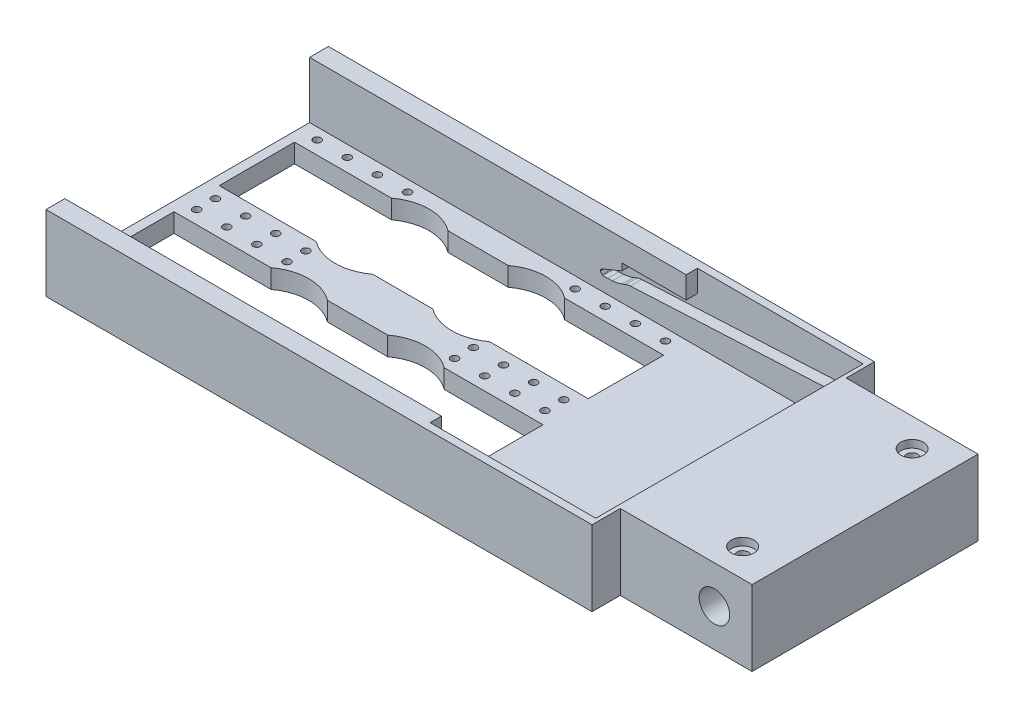
from build123d import *

# Parameters (mm, degrees)
SKETCH1_W           = 180
SKETCH1_H           = 75
SKETCH1_R           = 1.5
BOSS_EXTRUDE1_DEPTH = 20
SKETCH2_R           = 4.05
CUT_EXTRUDE1_DEPTH  = 119.84864324
SKETCH3_R           = 1
CUT_EXTRUDE2_DEPTH  = 100.530146245
SKETCH6_W           = 35
SKETCH6_H           = 7.5
CUT_EXTRUDE3_DEPTH  = 100.530146245
SKETCH7_W           = 140
SKETCH7_H           = 65
CUT_EXTRUDE4_DEPTH  = 15
SKETCH11_R          = 3
CUT_EXTRUDE7_DEPTH  = 2
CUT_EXTRUDE8_DEPTH  = 35.5


with BuildPart() as part:
    # Sketch1 → Boss-Extrude1 (new body)
    with BuildSketch(Plane(origin=(0, 0, 0), x_dir=(1, 0, 0), z_dir=(0, 1, 0))):
        Rectangle(SKETCH1_W, SKETCH1_H)
        with Locations(Location((80, 22.5, 0), (0, 0, 270))):
            Circle(SKETCH1_R, mode=Mode.SUBTRACT)
        with Locations(Location((80, -22.5, 0), (0, 0, 270))):
            Circle(SKETCH1_R, mode=Mode.SUBTRACT)
    extrude(amount=BOSS_EXTRUDE1_DEPTH)

    # Sketch2 → Cut-Extrude1 (cut, through all)
    with BuildSketch(Plane.XY.offset(37.5)):
        with Locations((80, 10)):
            Circle(SKETCH2_R)
    extrude(amount=-CUT_EXTRUDE1_DEPTH, mode=Mode.SUBTRACT)

    # Sketch3 → Cut-Extrude2 (cut, through all)
    with BuildSketch(Plane(origin=(0, 20, 0), x_dir=(1, 0, 0), z_dir=(0, 1, 0))):
        with Locations(Location((-85, 29.5, 0), (0, 0, 270))):
            Circle(SKETCH3_R)
        with Locations(Location((-85, 2.5, 0), (0, 0, 270))):
            Circle(SKETCH3_R)
        with Locations(Location((-77, 29.5, 0), (0, 0, 270))):
            Circle(SKETCH3_R)
        with Locations(Location((-69, 29.5, 0), (0, 0, 270))):
            Circle(SKETCH3_R)
        with Locations(Location((-61, 29.5, 0), (0, 0, 270))):
            Circle(SKETCH3_R)
        with Locations(Location((-77, 2.5, 0), (0, 0, 270))):
            Circle(SKETCH3_R)
        with Locations(Location((-69, 2.5, 0), (0, 0, 270))):
            Circle(SKETCH3_R)
        with Locations(Location((-61, 2.5, 0), (0, 0, 270))):
            Circle(SKETCH3_R)
        with Locations(Location((-16.5, 29.5, 0), (0, 0, 270))):
            Circle(SKETCH3_R)
        with Locations(Location((-16.5, 2.5, 0), (0, 0, 270))):
            Circle(SKETCH3_R)
        with Locations(Location((-8.5, 29.5, 0), (0, 0, 270))):
            Circle(SKETCH3_R)
        with Locations(Location((-0.5, 29.5, 0), (0, 0, 270))):
            Circle(SKETCH3_R)
        with Locations(Location((7.5, 29.5, 0), (0, 0, 270))):
            Circle(SKETCH3_R)
        with Locations(Location((-8.5, 2.5, 0), (0, 0, 270))):
            Circle(SKETCH3_R)
        with Locations(Location((-0.5, 2.5, 0), (0, 0, 270))):
            Circle(SKETCH3_R)
        with Locations(Location((7.5, 2.5, 0), (0, 0, 270))):
            Circle(SKETCH3_R)
        with Locations(Location((7.5, -2.5, 0), (0, 0, 90))):
            Circle(SKETCH3_R)
        with Locations(Location((-0.5, -2.5, 0), (0, 0, 90))):
            Circle(SKETCH3_R)
        with Locations(Location((-8.5, -2.5, 0), (0, 0, 90))):
            Circle(SKETCH3_R)
        with Locations(Location((7.5, -29.5, 0), (0, 0, 90))):
            Circle(SKETCH3_R)
        with Locations(Location((-0.5, -29.5, 0), (0, 0, 90))):
            Circle(SKETCH3_R)
        with Locations(Location((-8.5, -29.5, 0), (0, 0, 90))):
            Circle(SKETCH3_R)
        with Locations(Location((-16.5, -2.5, 0), (0, 0, 90))):
            Circle(SKETCH3_R)
        with Locations(Location((-16.5, -29.5, 0), (0, 0, 90))):
            Circle(SKETCH3_R)
        with Locations(Location((-61, -2.5, 0), (0, 0, 90))):
            Circle(SKETCH3_R)
        with Locations(Location((-69, -2.5, 0), (0, 0, 90))):
            Circle(SKETCH3_R)
        with Locations(Location((-77, -2.5, 0), (0, 0, 90))):
            Circle(SKETCH3_R)
        with Locations(Location((-61, -29.5, 0), (0, 0, 90))):
            Circle(SKETCH3_R)
        with Locations(Location((-69, -29.5, 0), (0, 0, 90))):
            Circle(SKETCH3_R)
        with Locations(Location((-77, -29.5, 0), (0, 0, 90))):
            Circle(SKETCH3_R)
        with Locations(Location((-85, -2.5, 0), (0, 0, 90))):
            Circle(SKETCH3_R)
        with Locations(Location((-85, -29.5, 0), (0, 0, 90))):
            Circle(SKETCH3_R)
        with BuildLine():
            Line((-87.5, 26), (-61.75, 26))
            ThreePointArc((-61.75, 26), (-54.25, 28.5), (-46.75, 26))
            Line((-46.75, 26), (-30.75, 26))
            ThreePointArc((-30.75, 26), (-23.25, 28.5), (-15.75, 26))
            Line((-15.75, 26), (10.5, 26))
            Line((10.5, 26), (10.5, 6))
            Line((10.5, 6), (-15.75, 6))
            ThreePointArc((-15.75, 6), (-23.25, 3.5), (-30.75, 6))
            Line((-30.75, 6), (-46.75, 6))
            ThreePointArc((-46.75, 6), (-54.25, 3.5), (-61.75, 6))
            Line((-61.75, 6), (-87.5, 6))
            Line((-87.5, 6), (-87.5, 26))
        make_face()
        with BuildLine():
            Line((10.5, -26), (10.5, -6))
            Line((10.5, -6), (-15.75, -6))
            ThreePointArc((-15.75, -6), (-23.25, -3.5), (-30.75, -6))
            Line((-30.75, -6), (-46.75, -6))
            ThreePointArc((-46.75, -6), (-54.25, -3.5), (-61.75, -6))
            Line((-61.75, -6), (-87.5, -6))
            Line((-87.5, -6), (-87.5, -26))
            Line((-87.5, -26), (-61.75, -26))
            ThreePointArc((-61.75, -26), (-54.25, -28.5), (-46.75, -26))
            Line((-46.75, -26), (-30.75, -26))
            ThreePointArc((-30.75, -26), (-23.25, -28.5), (-15.75, -26))
            Line((-15.75, -26), (10.5, -26))
        make_face()
    extrude(amount=-CUT_EXTRUDE2_DEPTH, mode=Mode.SUBTRACT)

    # Sketch6 → Cut-Extrude3 (cut, through all)
    with BuildSketch(Plane(origin=(0, 20, 0), x_dir=(1, 0, 0), z_dir=(0, 1, 0))):
        with Locations((72.5, 33.75)):
            Rectangle(SKETCH6_W, SKETCH6_H)
        with Locations((72.5, -33.75)):
            Rectangle(SKETCH6_W, SKETCH6_H)
    extrude(amount=-CUT_EXTRUDE3_DEPTH, mode=Mode.SUBTRACT)

    # Sketch7 → Cut-Extrude4 (cut)
    with BuildSketch(Plane(origin=(0, 20, 0), x_dir=(1, 0, 0), z_dir=(0, 1, 0))):
        with Locations((-20, 0)):
            Rectangle(SKETCH7_W, SKETCH7_H)
    extrude(amount=-CUT_EXTRUDE4_DEPTH, mode=Mode.SUBTRACT)

    # Sketch11 → Cut-Extrude7 (cut)
    with BuildSketch(Plane(origin=(0, 20, 0), x_dir=(1, 0, 0), z_dir=(0, 1, 0))):
        with Locations(Location((80, 22.5, 0), (0, 0, 270))):
            Circle(SKETCH11_R)
        with Locations(Location((80, -22.5, 0), (0, 0, 270))):
            Circle(SKETCH11_R)
    extrude(amount=-CUT_EXTRUDE7_DEPTH, mode=Mode.SUBTRACT)

    # Sketch10 → Cut-Extrude8 (cut, symmetric)
    with BuildSketch(Plane.XY):
        with BuildLine():
            Line((-4.787421847, 10.006405237), (15.9425, 11.042614814))
            Line((15.9425, 11.042614814), (54, 12.944963806))
            Line((54, 12.944963806), (54, 20))
            Line((54, 20), (10, 20))
            Line((10, 20), (10, 14.187228324))
            Line((10, 14.187228324), (-7.068255773, 14.187228324))
            Line((-7.068255773, 14.187228324), (-7.068255773, 12.3578248))
            Line((-7.068255773, 12.3578248), (-11.57158924, 10.495709598))
            Line((-11.57158924, 10.495709598), (-12.428069059, 10.069596832))
            ThreePointArc((-12.428069059, 10.069596832), (-12.487883392, 10.032586207), (-12.539874807, 9.985210754))
            Line((-12.539874807, 9.985210754), (-12.65097054, 9.863388736))
            ThreePointArc((-12.65097054, 9.863388736), (-12.701459244, 9.793565845), (-12.73496737, 9.714183537))
            Line((-12.73496737, 9.714183537), (-12.802647329, 9.484114261))
            ThreePointArc((-12.802647329, 9.484114261), (-12.80394317, 9.46097152), (-12.794823037, 9.43966216))
            Line((-12.794823037, 9.43966216), (-12.355882208, 8.843379967))
            ThreePointArc((-12.355882208, 8.843379967), (-12.273479479, 8.771258399), (-12.168372265, 8.740530496))
            Line((-12.168372265, 8.740530496), (-12.079275711, 8.734538457))
            ThreePointArc((-12.079275711, 8.734538457), (-11.475952659, 8.713137779), (-10.872485709, 8.73))
            Line((-10.872485709, 8.73), (-9.61386221, 8.805141688))
            ThreePointArc((-9.61386221, 8.805141688), (-8.220642268, 8.999819827), (-6.875574758, 9.411832907))
            Line((-6.875574758, 9.411832907), (-6.078515462, 9.72690509))
            ThreePointArc((-6.078515462, 9.72690509), (-5.444401074, 9.919464881), (-4.787421847, 10.006405237))
        make_face()
    extrude(amount=CUT_EXTRUDE8_DEPTH, both=True, mode=Mode.SUBTRACT)


solid = part.part
